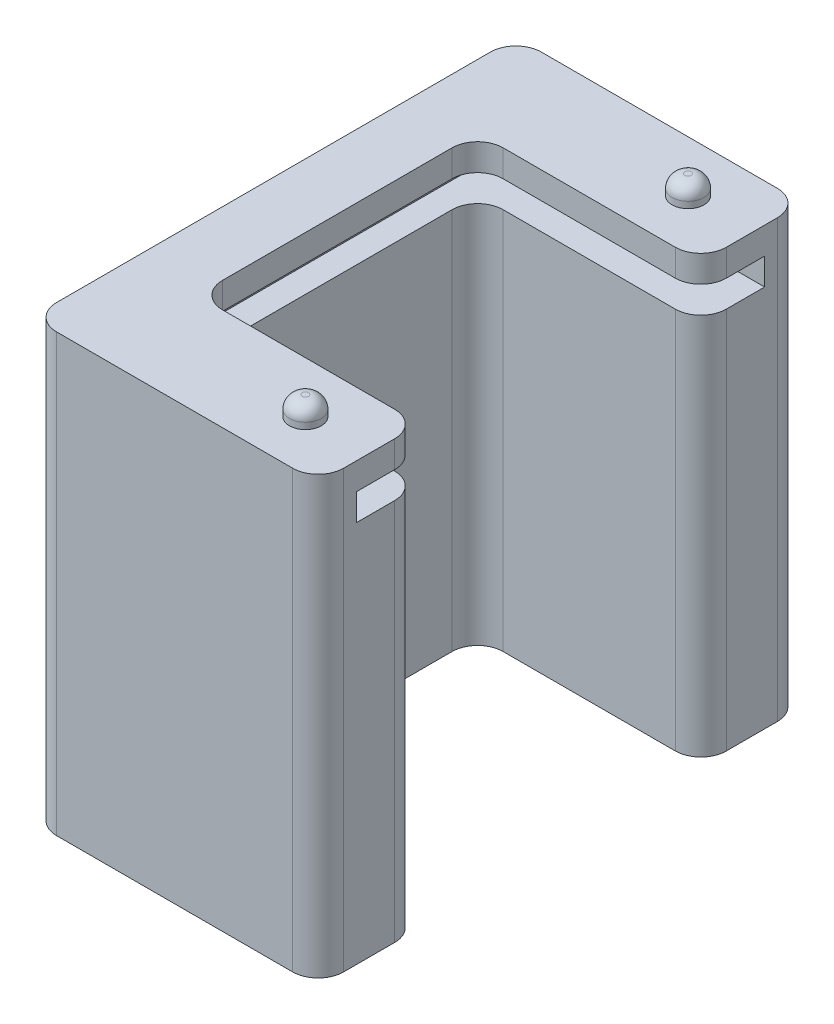
from build123d import *

# Parameters (mm, degrees)
SALIENTE_EXTRUIR1_DEPTH = 30
REDONDEO1_R             = 2
CROQUIS2_R              = 4
SALIENTE_EXTRUIR2_DEPTH = 12.2
SALIENTE_EXTRUIR3_START = 2.1
SALIENTE_EXTRUIR3_DEPTH = 2.1
SALIENTE_EXTRUIR4_START = 2.1
SALIENTE_EXTRUIR4_DEPTH = 2.1
CROQUIS5_R              = 1.25
SALIENTE_EXTRUIR5_DEPTH = 1.5
REDONDEO2_R             = 1
SALIENTE_EXTRUIR6_START = 1.5
CROQUIS6_R              = 1.25
SALIENTE_EXTRUIR6_DEPTH = 1.5
REDONDEO3_R             = 1
CROQUIS7_R              = 2.5
CORTAR_EXTRUIR1_DEPTH   = 10


with BuildPart() as part:
    # Croquis1 → Saliente-Extruir1 (new body)
    with BuildSketch(Plane(origin=(0, 0, 0), x_dir=(1, 0, 0), z_dir=(0, 1, 0))):
        Polygon((0, 0), (22.5, 0), (22.5, 8), (5, 8), (5, 30), (22.5, 30), (22.5, 38), (0, 38), align=None)
    extrude(amount=SALIENTE_EXTRUIR1_DEPTH)

    # Redondeo1
    redondeo1_edges = [part.edges().sort_by_distance(p)[0] for p in [
        (0, 15, -38),
        (22.5, 15, -38),
        (22.5, 15, -30),
        (5, 15, -30),
        (5, 15, -8),
        (22.5, 15, -8),
        (22.5, 15, 0),
        (0, 15, 0),
    ]]
    fillet(redondeo1_edges, radius=REDONDEO1_R)

    # Croquis2 → Saliente-Extruir2 (add)
    with BuildSketch(Plane.ZY):
        with Locations(Location((-19, 15, 0), (0, 0, 180))):
            Circle(CROQUIS2_R)
    extrude(amount=SALIENTE_EXTRUIR2_DEPTH)

    # Croquis3 → Saliente-Extruir3 (add)
    with BuildSketch(Plane(origin=(0, 30, 0), x_dir=(1, 0, 0), z_dir=(0, 1, 0)).offset(SALIENTE_EXTRUIR3_START)):
        with BuildLine():
            Line((20.5, 38), (2, 38))
            ThreePointArc((2, 38), (0.585786438, 37.414213562), (0, 36))
            Line((0, 36), (0, 2))
            ThreePointArc((0, 2), (0.585786438, 0.585786438), (2, 0))
            Line((2, 0), (20.5, 0))
            ThreePointArc((20.5, 0), (21.914213562, 0.585786438), (22.5, 2))
            Line((22.5, 2), (22.5, 3))
            Line((22.5, 3), (3, 3))
            Line((3, 3), (3, 35))
            Line((3, 35), (22.5, 35))
            Line((22.5, 35), (22.5, 36))
            ThreePointArc((22.5, 36), (21.914213562, 37.414213562), (20.5, 38))
        make_face()
    extrude(amount=-SALIENTE_EXTRUIR3_DEPTH)

    # Croquis4 → Saliente-Extruir4 (add)
    with BuildSketch(Plane(origin=(0, 32.1, 0), x_dir=(1, 0, 0), z_dir=(0, 1, 0)).offset(SALIENTE_EXTRUIR4_START)):
        with BuildLine():
            Line((22.5, 32), (22.5, 36))
            ThreePointArc((22.5, 36), (21.914213562, 37.414213562), (20.5, 38))
            Line((20.5, 38), (2, 38))
            ThreePointArc((2, 38), (0.585786438, 37.414213562), (0, 36))
            Line((0, 36), (0, 2))
            ThreePointArc((0, 2), (0.585786438, 0.585786438), (2, 0))
            Line((2, 0), (20.5, 0))
            ThreePointArc((20.5, 0), (21.914213562, 0.585786438), (22.5, 2))
            Line((22.5, 2), (22.5, 6))
            ThreePointArc((22.5, 6), (21.914213562, 7.414213562), (20.5, 8))
            Line((20.5, 8), (7, 8))
            ThreePointArc((7, 8), (5.585786438, 8.585786438), (5, 10))
            Line((5, 10), (5, 28))
            ThreePointArc((5, 28), (5.585786438, 29.414213562), (7, 30))
            Line((7, 30), (20.5, 30))
            ThreePointArc((20.5, 30), (21.914213562, 30.585786438), (22.5, 32))
        make_face()
    extrude(amount=-SALIENTE_EXTRUIR4_DEPTH)

    # Croquis5 → Saliente-Extruir5 (add)
    with BuildSketch(Plane(origin=(0, 34.2, 0), x_dir=(1, 0, 0), z_dir=(0, 1, 0))):
        with Locations(Location((17.5, 34, 0), (0, 0, 270))):
            Circle(CROQUIS5_R)
        with Locations(Location((17.5, 4, 0), (0, 0, 90))):
            Circle(CROQUIS5_R)
    extrude(amount=SALIENTE_EXTRUIR5_DEPTH)

    # Redondeo2
    redondeo2_edges = [part.edges().sort_by_distance(p)[0] for p in [
        (17.5, 35.7, -35.25),
        (17.5, 35.7, -2.75),
    ]]
    fillet(redondeo2_edges, radius=REDONDEO2_R)

    # Croquis6 → Saliente-Extruir6 (add)
    with BuildSketch(Plane.XZ.offset(SALIENTE_EXTRUIR6_START)):
        with Locations(Location((17.5, -4, 0), (0, 0, 270))):
            Circle(CROQUIS6_R)
        with Locations(Location((17.5, -34, 0), (0, 0, 90))):
            Circle(CROQUIS6_R)
    extrude(amount=-SALIENTE_EXTRUIR6_DEPTH)

    # Redondeo3
    redondeo3_edges = [part.edges().sort_by_distance(p)[0] for p in [
        (17.5, -1.5, -2.75),
        (17.5, -1.5, -35.25),
    ]]
    fillet(redondeo3_edges, radius=REDONDEO3_R)

    # Croquis7 → Cortar-Extruir1 (cut)
    with BuildSketch(Plane.ZY.offset(12.2)):
        with Locations((-19, 15)):
            Circle(CROQUIS7_R)
    extrude(amount=-CORTAR_EXTRUIR1_DEPTH, mode=Mode.SUBTRACT)


solid = part.part
